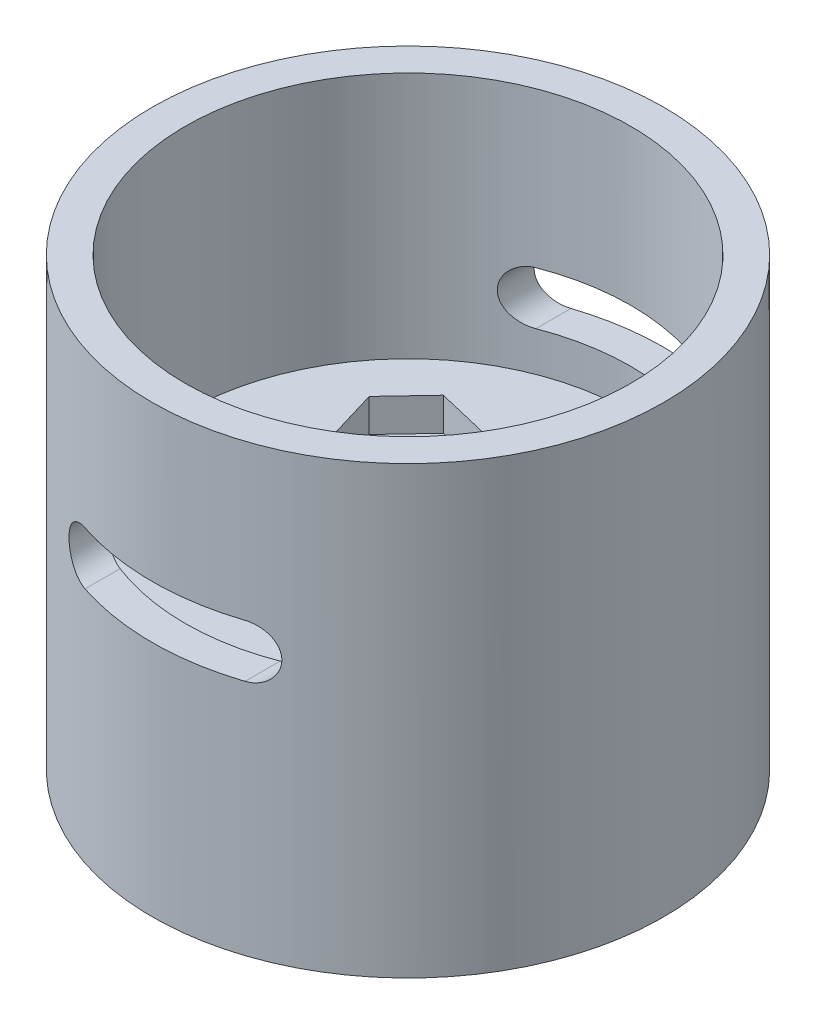
from build123d import *

# Parameters (mm, degrees)
SKETCH1_R               = 15.5
SKETCH1_R_2             = 13.5
BOSS_EXTRUDE1_DEPTH     = 18
SKETCH1_3_R             = 13.5
BOSS_EXTRUDE2_DEPTH     = 3
SKETCH2_R               = 5.2
SKETCH2_R_2             = 1.65
CUT_EXTRUDE4_DEPTH      = 41
CUT_EXTRUDE5_DEPTH      = 2
CUT_EXTRUDE6_DEPTH      = 20
CUT_EXTRUDE6_DEPTH_BACK = 16
BOSS_EXTRUDE3_START     = 9
SKETCH5_R               = 15.5
SKETCH5_R_2             = 13.5
BOSS_EXTRUDE3_DEPTH     = 9


with BuildPart() as part:
    # Sketch1 → Boss-Extrude1 (new body)
    with BuildSketch(Plane(origin=(0, 0, 0), x_dir=(1, 0, 0), z_dir=(0, 1, 0))):
        Circle(SKETCH1_R)
        Circle(SKETCH1_R_2, mode=Mode.SUBTRACT)
    extrude(amount=BOSS_EXTRUDE1_DEPTH)

    # Sketch1<3> → Boss-Extrude2 (add)
    with BuildSketch(Plane(origin=(0, 0, 0), x_dir=(1, 0, 0), z_dir=(0, 1, 0))):
        Circle(SKETCH1_3_R)
    extrude(amount=BOSS_EXTRUDE2_DEPTH)

    # Sketch2 → Cut-Extrude4 (cut)
    with BuildSketch(Plane(origin=(0, 3, 0), x_dir=(1, 0, 0), z_dir=(0, 1, 0))):
        Circle(SKETCH2_R)
        with Locations((-5.654252066, 5.659455236)):
            Circle(SKETCH2_R_2)
        with Locations((5.659455236, 5.654252066)):
            Circle(SKETCH2_R_2)
        with Locations((5.654252066, -5.659455236)):
            Circle(SKETCH2_R_2)
        with Locations((-5.659455236, -5.654252066)):
            Circle(SKETCH2_R_2)
    extrude(amount=-CUT_EXTRUDE4_DEPTH, mode=Mode.SUBTRACT)

    # Sketch3 → Cut-Extrude5 (cut)
    with BuildSketch(Plane(origin=(0, 3, 0), x_dir=(1, 0, 0), z_dir=(0, 1, 0))):
        Polygon((-7.834437444, 3.350748878), (-4.744946398, 2.617006135), (-2.56476102, 4.925712494), (-3.474066688, 7.968161595), (-6.563557734, 8.701904338), (-8.743743112, 6.393197979), align=None)
        Polygon((3.350748878, 7.834437444), (2.617006135, 4.744946398), (4.925712494, 2.56476102), (7.968161595, 3.474066688), (8.701904338, 6.563557734), (6.393197979, 8.743743112), align=None)
        Polygon((7.834437444, -3.350748878), (4.744946398, -2.617006135), (2.56476102, -4.925712494), (3.474066688, -7.968161595), (6.563557734, -8.701904338), (8.743743112, -6.393197979), align=None)
        Polygon((-3.350748878, -7.834437444), (-2.617006135, -4.744946398), (-4.925712494, -2.56476102), (-7.968161595, -3.474066688), (-8.701904338, -6.563557734), (-6.393197979, -8.743743112), align=None)
    extrude(amount=-CUT_EXTRUDE5_DEPTH, mode=Mode.SUBTRACT)

    # Sketch4 → Cut-Extrude6 (cut, two sides: drawn at the far end of the back side and taken through both)
    with BuildSketch(Plane.XY.offset(-CUT_EXTRUDE6_DEPTH_BACK)):
        with BuildLine():
            Line((4.848949803, 5.4), (-4.848949803, 5.4))
            ThreePointArc((-4.848949803, 5.4), (-6.448949803, 7), (-4.848949803, 8.6))
            Line((-4.848949803, 8.6), (4.848949803, 8.6))
            ThreePointArc((4.848949803, 8.6), (6.448949803, 7), (4.848949803, 5.4))
        make_face()
    extrude(amount=CUT_EXTRUDE6_DEPTH + CUT_EXTRUDE6_DEPTH_BACK, mode=Mode.SUBTRACT)

    # Sketch5 → Boss-Extrude3 (add)
    with BuildSketch(Plane.XZ.offset(BOSS_EXTRUDE3_START)):
        Circle(SKETCH5_R)
        Circle(SKETCH5_R_2, mode=Mode.SUBTRACT)
    extrude(amount=-BOSS_EXTRUDE3_DEPTH)


solid = part.part
